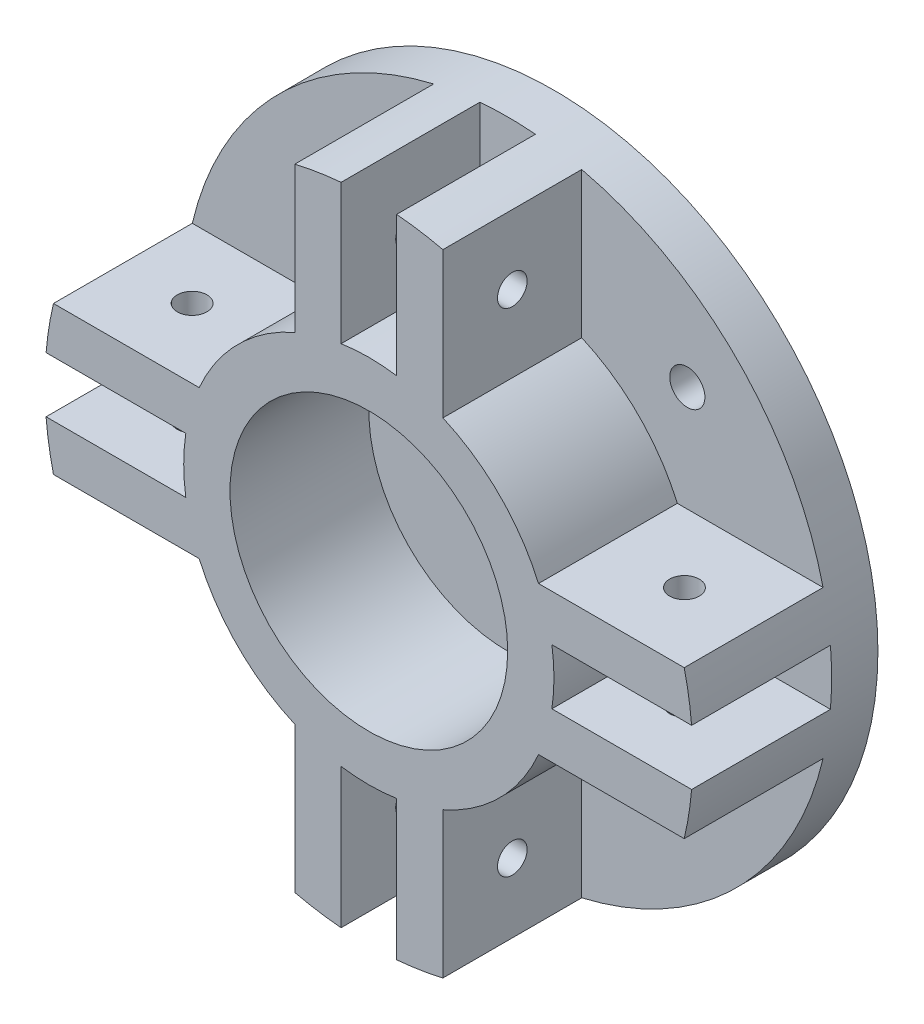
from build123d import *

# Parameters (mm, degrees)
SKETCH2_R           = 35
SKETCH2_R_2         = 5
BOSS_EXTRUDE1_DEPTH = 5
SKETCH3_R           = 20
SKETCH3_R_2         = 15
BOSS_EXTRUDE3_DEPTH = 15
SKETCH4_R           = 1.6
CUT_EXTRUDE1_DEPTH  = 59.940648113
CIRPATTERN1_COUNT   = 4
SKETCH5_R           = 1.9
SKETCH5_R_2         = 1.25
CUT_EXTRUDE2_DEPTH  = 52.720402164


with BuildPart() as part:
    # Sketch2 → Boss-Extrude1 (new body)
    with BuildSketch(Plane.XY):
        Circle(SKETCH2_R)
        Circle(SKETCH2_R_2, mode=Mode.SUBTRACT)
    extrude(amount=BOSS_EXTRUDE1_DEPTH)

    # Sketch3 → Boss-Extrude3 (add)
    # profile 1 of 9: a face of its own
    with BuildSketch(Plane.XY.offset(5)):
        with BuildLine():
            ThreePointArc((-3, -19.773719933), (-5.547149112, -19.215335978), (-8, -18.33030278))
            Line((-8, -18.33030278), (-8, -34.073450075))
            ThreePointArc((-8, -34.073450075), (-5.514444475, -34.562854369), (-3, -34.871191548))
            Line((-3, -34.871191548), (-3, -19.773719933))
        make_face()
    # profile 2 of 9: a face of its own
    with BuildSketch(Plane.XY.offset(5)):
        with BuildLine():
            Line((8, -34.073450075), (8, -18.33030278))
            ThreePointArc((8, -18.33030278), (5.547149112, -19.215335978), (3, -19.773719933))
            Line((3, -19.773719933), (3, -34.871191548))
            ThreePointArc((3, -34.871191548), (5.514444475, -34.562854369), (8, -34.073450075))
        make_face()
    # profile 3 of 9: a face of its own
    with BuildSketch(Plane.XY.offset(5)):
        with BuildLine():
            Line((34.871191548, -3), (19.773719933, -3))
            ThreePointArc((19.773719933, -3), (19.215335978, -5.547149112), (18.33030278, -8))
            Line((18.33030278, -8), (34.073450075, -8))
            ThreePointArc((34.073450075, -8), (34.562854369, -5.514444475), (34.871191548, -3))
        make_face()
    # profile 4 of 9: a face of its own
    with BuildSketch(Plane.XY.offset(5)):
        with BuildLine():
            Line((34.073450075, 8), (18.33030278, 8))
            ThreePointArc((18.33030278, 8), (19.215335978, 5.547149112), (19.773719933, 3))
            Line((19.773719933, 3), (34.871191548, 3))
            ThreePointArc((34.871191548, 3), (34.562854369, 5.514444475), (34.073450075, 8))
        make_face()
    # profile 5 of 9: a face of its own
    with BuildSketch(Plane.XY.offset(5)):
        with BuildLine():
            Line((3, 34.871191548), (3, 19.773719933))
            ThreePointArc((3, 19.773719933), (5.547149112, 19.215335978), (8, 18.33030278))
            Line((8, 18.33030278), (8, 34.073450075))
            ThreePointArc((8, 34.073450075), (5.514444475, 34.562854369), (3, 34.871191548))
        make_face()
    # profile 6 of 9: a face of its own
    with BuildSketch(Plane.XY.offset(5)):
        with BuildLine():
            ThreePointArc((-8, 18.33030278), (-5.547149112, 19.215335978), (-3, 19.773719933))
            Line((-3, 19.773719933), (-3, 34.871191548))
            ThreePointArc((-3, 34.871191548), (-5.514444475, 34.562854369), (-8, 34.073450075))
            Line((-8, 34.073450075), (-8, 18.33030278))
        make_face()
    # profile 7 of 9: a face of its own
    with BuildSketch(Plane.XY.offset(5)):
        with BuildLine():
            ThreePointArc((-19.773719933, 3), (-19.215335978, 5.547149112), (-18.33030278, 8))
            Line((-18.33030278, 8), (-34.073450075, 8))
            ThreePointArc((-34.073450075, 8), (-34.562854369, 5.514444475), (-34.871191548, 3))
            Line((-34.871191548, 3), (-19.773719933, 3))
        make_face()
    # profile 8 of 9: a face of its own
    with BuildSketch(Plane.XY.offset(5)):
        with BuildLine():
            ThreePointArc((-18.33030278, -8), (-19.215335978, -5.547149112), (-19.773719933, -3))
            Line((-19.773719933, -3), (-34.871191548, -3))
            ThreePointArc((-34.871191548, -3), (-34.562854369, -5.514444475), (-34.073450075, -8))
            Line((-34.073450075, -8), (-18.33030278, -8))
        make_face()
    # profile 9 of 9: a face of its own
    with BuildSketch(Plane.XY.offset(5)):
        Circle(SKETCH3_R)
        Circle(SKETCH3_R_2, mode=Mode.SUBTRACT)
    extrude(amount=BOSS_EXTRUDE3_DEPTH)

    # Sketch4 → Cut-Extrude1 (cut, through all)
    with BuildSketch(Plane.ZY.offset(8)):
        with Locations((12.5, 26.596250524)):
            Circle(SKETCH4_R)
    cut_extrude1 = extrude(amount=-CUT_EXTRUDE1_DEPTH, mode=Mode.SUBTRACT)

    # CirPattern1: Cut-Extrude1 ×4 about axis
    cirpattern1_axis = Axis((0, 0, 20), (0, 0, -1))
    for i in range(1, CIRPATTERN1_COUNT):
        add(cut_extrude1.rotate(cirpattern1_axis, i * 360 / CIRPATTERN1_COUNT), mode=Mode.SUBTRACT)

    # Sketch5 → Cut-Extrude2 (cut, through all)
    with BuildSketch(Plane.XY.offset(5)):
        with Locations((19.405170255, 19.413249431)):
            Circle(SKETCH5_R)
        with Locations((-19.525765468, -19.291950885)):
            Circle(SKETCH5_R_2)
    extrude(amount=-CUT_EXTRUDE2_DEPTH, mode=Mode.SUBTRACT)


solid = part.part
